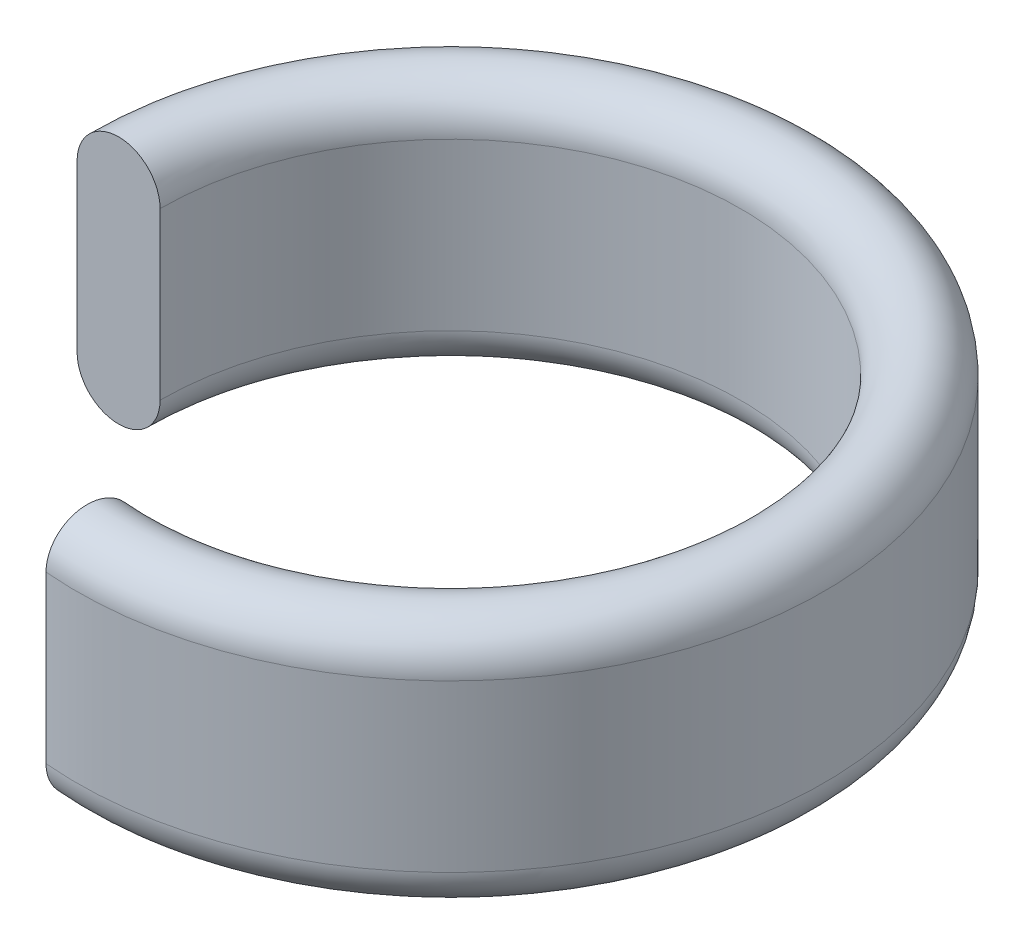
from build123d import *

# Parameters (mm, degrees)
REVOLVE1_ANGLE = 275


with BuildPart() as part:
    # Sketch1 → Revolve1 (revolve)
    with BuildSketch(Plane.XY):
        with BuildLine():
            Line((-22.5, -5), (-22.5, 5))
            ThreePointArc((-22.5, 5), (-20, 7.5), (-17.5, 5))
            Line((-17.5, 5), (-17.5, -5))
            ThreePointArc((-17.5, -5), (-20, -7.5), (-22.5, -5))
        make_face()
    revolve(axis=Axis((0, 8.757264849, 0), (0, -1, 0)), revolution_arc=REVOLVE1_ANGLE)


solid = part.part
